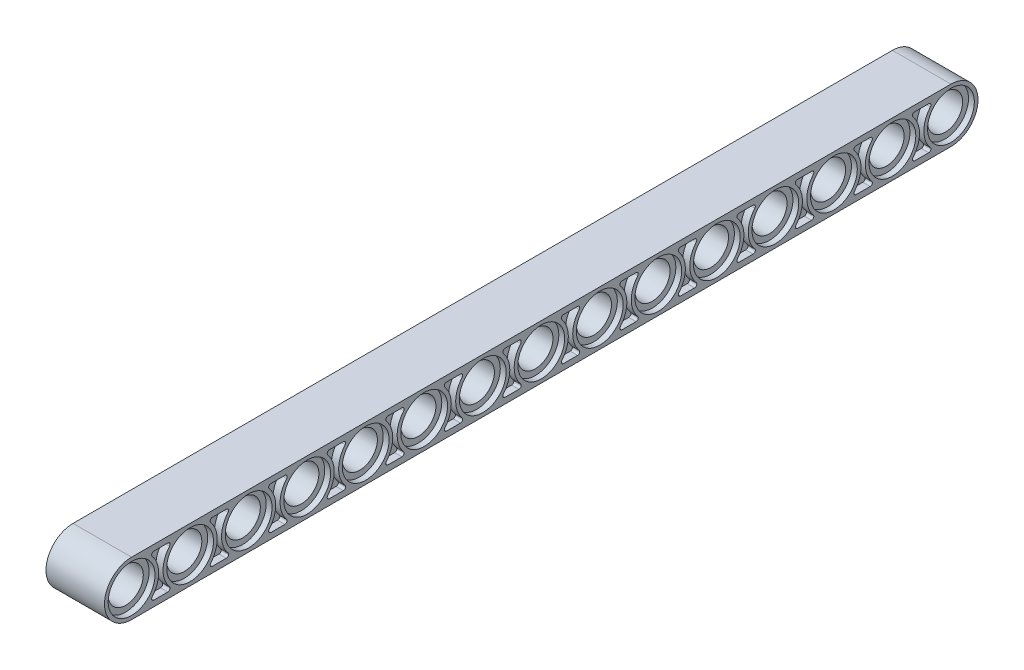
from build123d import *

# Parameters (mm, degrees)
SKETCH1_R           = 2.4
BOSS_EXTRUDE1_DEPTH = 8
CUT_EXTRUDE1_START  = -1
CUT_EXTRUDE1_DEPTH  = 1
SKETCH3_R           = 3.2
CUT_EXTRUDE2_DEPTH  = 0.8


with BuildPart() as part:
    # Sketch1 → Boss-Extrude1 (new body)
    with BuildSketch(Plane(origin=(0, 0, 0), x_dir=(0, 0, -1), z_dir=(1, 0, 0))):
        with BuildLine():
            Line((-29.185046729, 3.7), (82.814953271, 3.7))
            ThreePointArc((82.814953271, 3.7), (86.514953271, 0), (82.814953271, -3.7))
            Line((82.814953271, -3.7), (-29.185046729, -3.7))
            ThreePointArc((-29.185046729, -3.7), (-32.885046729, 0), (-29.185046729, 3.7))
        make_face()
        with Locations((-29.185046729, 0)):
            Circle(SKETCH1_R, mode=Mode.SUBTRACT)
        with Locations((-21.185046729, 0)):
            Circle(SKETCH1_R, mode=Mode.SUBTRACT)
        with Locations((-13.185046729, 0)):
            Circle(SKETCH1_R, mode=Mode.SUBTRACT)
        with Locations((-5.185046729, 0)):
            Circle(SKETCH1_R, mode=Mode.SUBTRACT)
        with Locations((2.814953271, 0)):
            Circle(SKETCH1_R, mode=Mode.SUBTRACT)
        with Locations((10.814953271, 0)):
            Circle(SKETCH1_R, mode=Mode.SUBTRACT)
        with Locations((18.814953271, 0)):
            Circle(SKETCH1_R, mode=Mode.SUBTRACT)
        with Locations((26.814953271, 0)):
            Circle(SKETCH1_R, mode=Mode.SUBTRACT)
        with Locations((34.814953271, 0)):
            Circle(SKETCH1_R, mode=Mode.SUBTRACT)
        with Locations((42.814953271, 0)):
            Circle(SKETCH1_R, mode=Mode.SUBTRACT)
        with Locations((50.814953271, 0)):
            Circle(SKETCH1_R, mode=Mode.SUBTRACT)
        with Locations((58.814953271, 0)):
            Circle(SKETCH1_R, mode=Mode.SUBTRACT)
        with Locations((66.814953271, 0)):
            Circle(SKETCH1_R, mode=Mode.SUBTRACT)
        with Locations((74.814953271, 0)):
            Circle(SKETCH1_R, mode=Mode.SUBTRACT)
        with Locations((82.814953271, 0)):
            Circle(SKETCH1_R, mode=Mode.SUBTRACT)
    extrude(amount=BOSS_EXTRUDE1_DEPTH)

    # Sketch2 → Cut-Extrude1 (cut)
    with BuildSketch(Plane(origin=(8, 0, 0), x_dir=(0, 0, -1), z_dir=(1, 0, 0)).offset(CUT_EXTRUDE1_START)):
        with BuildLine():
            Line((-26.145309898, 2.9), (-24.22478356, 2.9))
            ThreePointArc((-24.22478356, 2.9), (-23.952295028, 2.725499004), (-23.996803297, 2.405))
            ThreePointArc((-23.996803297, 2.405), (-24.885046729, 0), (-23.996803297, -2.405))
            ThreePointArc((-23.996803297, -2.405), (-23.952295028, -2.725499004), (-24.22478356, -2.9))
            Line((-24.22478356, -2.9), (-26.145309898, -2.9))
            ThreePointArc((-26.145309898, -2.9), (-26.41779843, -2.725499004), (-26.373290161, -2.405))
            ThreePointArc((-26.373290161, -2.405), (-25.485046729, 0), (-26.373290161, 2.405))
            ThreePointArc((-26.373290161, 2.405), (-26.41779843, 2.725499004), (-26.145309898, 2.9))
        make_face()
        with BuildLine():
            Line((-18.145309898, 2.9), (-16.22478356, 2.9))
            ThreePointArc((-16.22478356, 2.9), (-15.952295028, 2.725499004), (-15.996803297, 2.405))
            ThreePointArc((-15.996803297, 2.405), (-16.885046729, 0), (-15.996803297, -2.405))
            ThreePointArc((-15.996803297, -2.405), (-15.952295028, -2.725499004), (-16.22478356, -2.9))
            Line((-16.22478356, -2.9), (-18.145309898, -2.9))
            ThreePointArc((-18.145309898, -2.9), (-18.41779843, -2.725499004), (-18.373290161, -2.405))
            ThreePointArc((-18.373290161, -2.405), (-17.485046729, 0), (-18.373290161, 2.405))
            ThreePointArc((-18.373290161, 2.405), (-18.41779843, 2.725499004), (-18.145309898, 2.9))
        make_face()
        with BuildLine():
            Line((-10.145309898, 2.9), (-8.22478356, 2.9))
            ThreePointArc((-8.22478356, 2.9), (-7.952295028, 2.725499004), (-7.996803297, 2.405))
            ThreePointArc((-7.996803297, 2.405), (-8.885046729, 0), (-7.996803297, -2.405))
            ThreePointArc((-7.996803297, -2.405), (-7.952295028, -2.725499004), (-8.22478356, -2.9))
            Line((-8.22478356, -2.9), (-10.145309898, -2.9))
            ThreePointArc((-10.145309898, -2.9), (-10.41779843, -2.725499004), (-10.373290161, -2.405))
            ThreePointArc((-10.373290161, -2.405), (-9.485046729, 0), (-10.373290161, 2.405))
            ThreePointArc((-10.373290161, 2.405), (-10.41779843, 2.725499004), (-10.145309898, 2.9))
        make_face()
        with BuildLine():
            Line((-2.145309898, 2.9), (-0.22478356, 2.9))
            ThreePointArc((-0.22478356, 2.9), (0.047704972, 2.725499004), (0.003196703, 2.405))
            ThreePointArc((0.003196703, 2.405), (-0.885046729, 0), (0.003196703, -2.405))
            ThreePointArc((0.003196703, -2.405), (0.047704972, -2.725499004), (-0.22478356, -2.9))
            Line((-0.22478356, -2.9), (-2.145309898, -2.9))
            ThreePointArc((-2.145309898, -2.9), (-2.41779843, -2.725499004), (-2.373290161, -2.405))
            ThreePointArc((-2.373290161, -2.405), (-1.485046729, 0), (-2.373290161, 2.405))
            ThreePointArc((-2.373290161, 2.405), (-2.41779843, 2.725499004), (-2.145309898, 2.9))
        make_face()
        with BuildLine():
            Line((5.854690102, 2.9), (7.77521644, 2.9))
            ThreePointArc((7.77521644, 2.9), (8.047704972, 2.725499004), (8.003196703, 2.405))
            ThreePointArc((8.003196703, 2.405), (7.114953271, 0), (8.003196703, -2.405))
            ThreePointArc((8.003196703, -2.405), (8.047704972, -2.725499004), (7.77521644, -2.9))
            Line((7.77521644, -2.9), (5.854690102, -2.9))
            ThreePointArc((5.854690102, -2.9), (5.58220157, -2.725499004), (5.626709839, -2.405))
            ThreePointArc((5.626709839, -2.405), (6.514953271, 0), (5.626709839, 2.405))
            ThreePointArc((5.626709839, 2.405), (5.58220157, 2.725499004), (5.854690102, 2.9))
        make_face()
        with BuildLine():
            Line((13.854690102, 2.9), (15.77521644, 2.9))
            ThreePointArc((15.77521644, 2.9), (16.047704972, 2.725499004), (16.003196703, 2.405))
            ThreePointArc((16.003196703, 2.405), (15.114953271, 0), (16.003196703, -2.405))
            ThreePointArc((16.003196703, -2.405), (16.047704972, -2.725499004), (15.77521644, -2.9))
            Line((15.77521644, -2.9), (13.854690102, -2.9))
            ThreePointArc((13.854690102, -2.9), (13.58220157, -2.725499004), (13.626709839, -2.405))
            ThreePointArc((13.626709839, -2.405), (14.514953271, 0), (13.626709839, 2.405))
            ThreePointArc((13.626709839, 2.405), (13.58220157, 2.725499004), (13.854690102, 2.9))
        make_face()
        with BuildLine():
            Line((21.854690102, 2.9), (23.77521644, 2.9))
            ThreePointArc((23.77521644, 2.9), (24.047704972, 2.725499004), (24.003196703, 2.405))
            ThreePointArc((24.003196703, 2.405), (23.114953271, 0), (24.003196703, -2.405))
            ThreePointArc((24.003196703, -2.405), (24.047704972, -2.725499004), (23.77521644, -2.9))
            Line((23.77521644, -2.9), (21.854690102, -2.9))
            ThreePointArc((21.854690102, -2.9), (21.58220157, -2.725499004), (21.626709839, -2.405))
            ThreePointArc((21.626709839, -2.405), (22.514953271, 0), (21.626709839, 2.405))
            ThreePointArc((21.626709839, 2.405), (21.58220157, 2.725499004), (21.854690102, 2.9))
        make_face()
        with BuildLine():
            Line((29.854690102, 2.9), (31.77521644, 2.9))
            ThreePointArc((31.77521644, 2.9), (32.047704972, 2.725499004), (32.003196703, 2.405))
            ThreePointArc((32.003196703, 2.405), (31.114953271, 0), (32.003196703, -2.405))
            ThreePointArc((32.003196703, -2.405), (32.047704972, -2.725499004), (31.77521644, -2.9))
            Line((31.77521644, -2.9), (29.854690102, -2.9))
            ThreePointArc((29.854690102, -2.9), (29.58220157, -2.725499004), (29.626709839, -2.405))
            ThreePointArc((29.626709839, -2.405), (30.514953271, 0), (29.626709839, 2.405))
            ThreePointArc((29.626709839, 2.405), (29.58220157, 2.725499004), (29.854690102, 2.9))
        make_face()
        with BuildLine():
            Line((37.854690102, 2.9), (39.77521644, 2.9))
            ThreePointArc((39.77521644, 2.9), (40.047704972, 2.725499004), (40.003196703, 2.405))
            ThreePointArc((40.003196703, 2.405), (39.114953271, 0), (40.003196703, -2.405))
            ThreePointArc((40.003196703, -2.405), (40.047704972, -2.725499004), (39.77521644, -2.9))
            Line((39.77521644, -2.9), (37.854690102, -2.9))
            ThreePointArc((37.854690102, -2.9), (37.58220157, -2.725499004), (37.626709839, -2.405))
            ThreePointArc((37.626709839, -2.405), (38.514953271, 0), (37.626709839, 2.405))
            ThreePointArc((37.626709839, 2.405), (37.58220157, 2.725499004), (37.854690102, 2.9))
        make_face()
        with BuildLine():
            Line((45.854690102, 2.9), (47.77521644, 2.9))
            ThreePointArc((47.77521644, 2.9), (48.047704972, 2.725499004), (48.003196703, 2.405))
            ThreePointArc((48.003196703, 2.405), (47.114953271, 0), (48.003196703, -2.405))
            ThreePointArc((48.003196703, -2.405), (48.047704972, -2.725499004), (47.77521644, -2.9))
            Line((47.77521644, -2.9), (45.854690102, -2.9))
            ThreePointArc((45.854690102, -2.9), (45.58220157, -2.725499004), (45.626709839, -2.405))
            ThreePointArc((45.626709839, -2.405), (46.514953271, 0), (45.626709839, 2.405))
            ThreePointArc((45.626709839, 2.405), (45.58220157, 2.725499004), (45.854690102, 2.9))
        make_face()
        with BuildLine():
            Line((53.854690102, 2.9), (55.77521644, 2.9))
            ThreePointArc((55.77521644, 2.9), (56.047704972, 2.725499004), (56.003196703, 2.405))
            ThreePointArc((56.003196703, 2.405), (55.114953271, 0), (56.003196703, -2.405))
            ThreePointArc((56.003196703, -2.405), (56.047704972, -2.725499004), (55.77521644, -2.9))
            Line((55.77521644, -2.9), (53.854690102, -2.9))
            ThreePointArc((53.854690102, -2.9), (53.58220157, -2.725499004), (53.626709839, -2.405))
            ThreePointArc((53.626709839, -2.405), (54.514953271, 0), (53.626709839, 2.405))
            ThreePointArc((53.626709839, 2.405), (53.58220157, 2.725499004), (53.854690102, 2.9))
        make_face()
        with BuildLine():
            Line((61.854690102, 2.9), (63.77521644, 2.9))
            ThreePointArc((63.77521644, 2.9), (64.047704972, 2.725499004), (64.003196703, 2.405))
            ThreePointArc((64.003196703, 2.405), (63.114953271, 0), (64.003196703, -2.405))
            ThreePointArc((64.003196703, -2.405), (64.047704972, -2.725499004), (63.77521644, -2.9))
            Line((63.77521644, -2.9), (61.854690102, -2.9))
            ThreePointArc((61.854690102, -2.9), (61.58220157, -2.725499004), (61.626709839, -2.405))
            ThreePointArc((61.626709839, -2.405), (62.514953271, 0), (61.626709839, 2.405))
            ThreePointArc((61.626709839, 2.405), (61.58220157, 2.725499004), (61.854690102, 2.9))
        make_face()
        with BuildLine():
            Line((69.854690102, 2.9), (71.77521644, 2.9))
            ThreePointArc((71.77521644, 2.9), (72.047704972, 2.725499004), (72.003196703, 2.405))
            ThreePointArc((72.003196703, 2.405), (71.114953271, 0), (72.003196703, -2.405))
            ThreePointArc((72.003196703, -2.405), (72.047704972, -2.725499004), (71.77521644, -2.9))
            Line((71.77521644, -2.9), (69.854690102, -2.9))
            ThreePointArc((69.854690102, -2.9), (69.58220157, -2.725499004), (69.626709839, -2.405))
            ThreePointArc((69.626709839, -2.405), (70.514953271, 0), (69.626709839, 2.405))
            ThreePointArc((69.626709839, 2.405), (69.58220157, 2.725499004), (69.854690102, 2.9))
        make_face()
        with BuildLine():
            Line((77.854690102, 2.9), (79.77521644, 2.9))
            ThreePointArc((79.77521644, 2.9), (80.047704972, 2.725499004), (80.003196703, 2.405))
            ThreePointArc((80.003196703, 2.405), (79.114953271, 0), (80.003196703, -2.405))
            ThreePointArc((80.003196703, -2.405), (80.047704972, -2.725499004), (79.77521644, -2.9))
            Line((79.77521644, -2.9), (77.854690102, -2.9))
            ThreePointArc((77.854690102, -2.9), (77.58220157, -2.725499004), (77.626709839, -2.405))
            ThreePointArc((77.626709839, -2.405), (78.514953271, 0), (77.626709839, 2.405))
            ThreePointArc((77.626709839, 2.405), (77.58220157, 2.725499004), (77.854690102, 2.9))
        make_face()
    cut_extrude1 = extrude(amount=CUT_EXTRUDE1_DEPTH, mode=Mode.SUBTRACT)

    # Sketch3 → Cut-Extrude2 (cut)
    with BuildSketch(Plane(origin=(8, 0, 0), x_dir=(0, 0, -1), z_dir=(1, 0, 0))):
        with Locations((-29.185046729, 0)):
            Circle(SKETCH3_R)
        with Locations((-21.185046729, 0)):
            Circle(SKETCH3_R)
        with Locations((-13.185046729, 0)):
            Circle(SKETCH3_R)
        with Locations((-5.185046729, 0)):
            Circle(SKETCH3_R)
        with Locations((2.814953271, 0)):
            Circle(SKETCH3_R)
        with Locations((10.814953271, 0)):
            Circle(SKETCH3_R)
        with Locations((18.814953271, 0)):
            Circle(SKETCH3_R)
        with Locations((26.814953271, 0)):
            Circle(SKETCH3_R)
        with Locations((34.814953271, 0)):
            Circle(SKETCH3_R)
        with Locations((42.814953271, 0)):
            Circle(SKETCH3_R)
        with Locations((50.814953271, 0)):
            Circle(SKETCH3_R)
        with Locations((58.814953271, 0)):
            Circle(SKETCH3_R)
        with Locations((66.814953271, 0)):
            Circle(SKETCH3_R)
        with Locations((74.814953271, 0)):
            Circle(SKETCH3_R)
        with Locations((82.814953271, 0)):
            Circle(SKETCH3_R)
    cut_extrude2 = extrude(amount=-CUT_EXTRUDE2_DEPTH, mode=Mode.SUBTRACT)

    # Mirror1: Cut-Extrude1, Cut-Extrude2 across plane
    add(cut_extrude1.mirror(Plane(origin=(4, 0, 0), x_dir=(0, 0, 1), z_dir=(1, 0, 0))), mode=Mode.SUBTRACT)
    add(cut_extrude2.mirror(Plane(origin=(4, 0, 0), x_dir=(0, 0, 1), z_dir=(1, 0, 0))), mode=Mode.SUBTRACT)


solid = part.part
